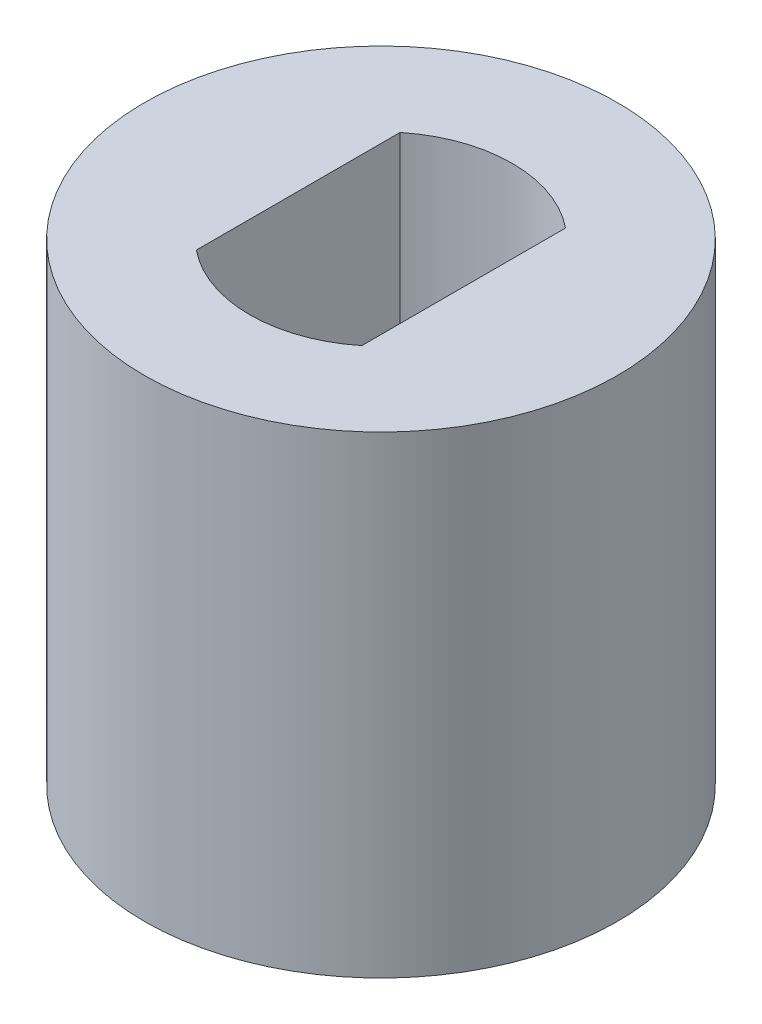
from build123d import *

# Parameters (mm, degrees)
SKETCH1_R           = 5
BOSS_EXTRUDE1_DEPTH = 10


with BuildPart() as part:
    # Sketch1 → Boss-Extrude1 (new body)
    with BuildSketch(Plane(origin=(0, 0, 0), x_dir=(1, 0, 0), z_dir=(0, 1, 0))):
        with Locations(Location((0, 0, 0), (0, 0, 270))):
            Circle(SKETCH1_R)
        with BuildLine():
            Line((-1.75, 2.153630655), (-1.75, -2.153630655))
            ThreePointArc((-1.75, -2.153630655), (0, -2.775), (1.75, -2.153630655))
            Line((1.75, -2.153630655), (1.75, 2.153630655))
            ThreePointArc((1.75, 2.153630655), (0, 2.775), (-1.75, 2.153630655))
        make_face(mode=Mode.SUBTRACT)
    extrude(amount=BOSS_EXTRUDE1_DEPTH)


solid = part.part
